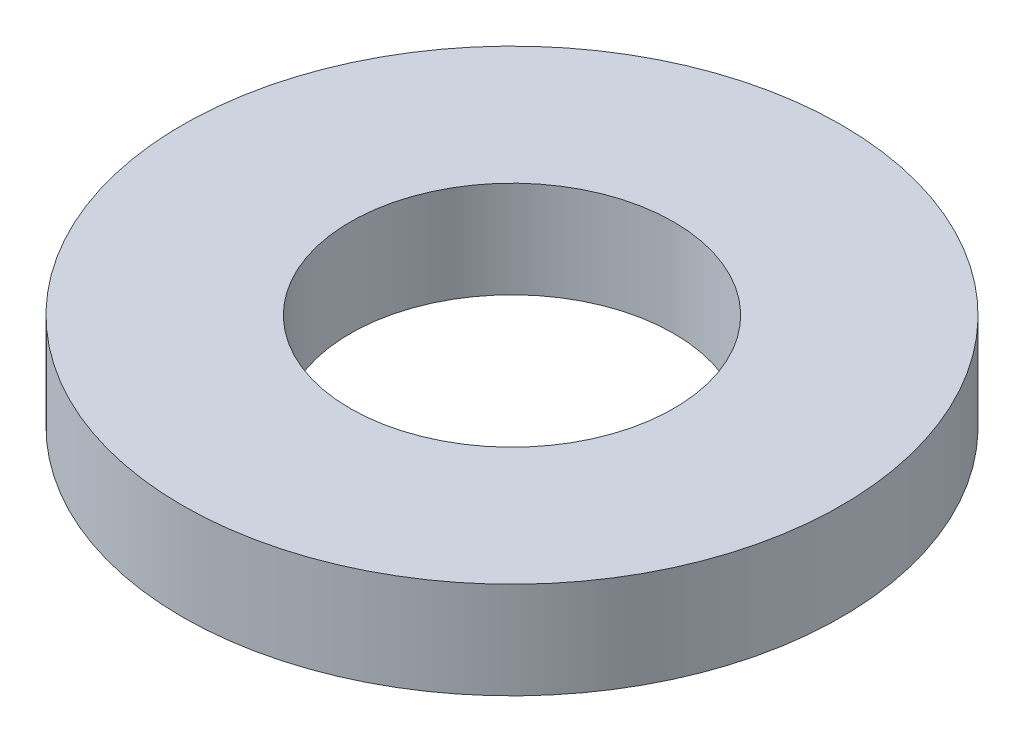
from build123d import *

# Parameters (mm, degrees)
SKETCH1_R           = 4.7625
BOSS_EXTRUDE1_DEPTH = 1.397
SKETCH5_R           = 2.3368
CUT_EXTRUDE1_DEPTH  = 7.878547921


with BuildPart() as part:
    # Sketch1 → Boss-Extrude1 (new body)
    with BuildSketch(Plane(origin=(0, 0, 0), x_dir=(1, 0, 0), z_dir=(0, 1, 0))):
        with Locations(Location((0, 0, 0), (0, 0, 270))):
            Circle(SKETCH1_R)
    extrude(amount=BOSS_EXTRUDE1_DEPTH)

    # Sketch5 → Cut-Extrude1 (cut, through all)
    with BuildSketch(Plane(origin=(0, 1.397, 0), x_dir=(-1, 0, 0), z_dir=(0, 1, 0))):
        with Locations(Location((0, 0, 0), (0, 0, 90))):
            Circle(SKETCH5_R)
    extrude(amount=-CUT_EXTRUDE1_DEPTH, mode=Mode.SUBTRACT)


solid = part.part
